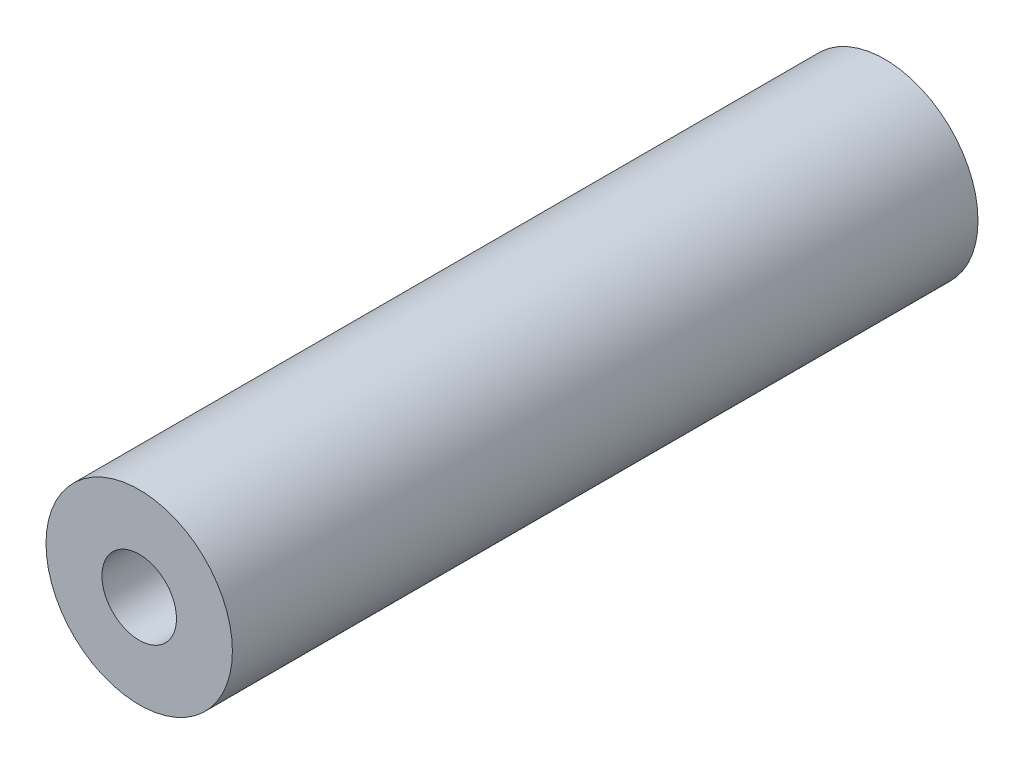
from build123d import *

# Parameters (mm, degrees)
STANDOFF_OD8_ID3P2_PROFILE_R   = 4
STANDOFF_OD8_ID3P2_PROFILE_R_2 = 1.6
STANDOFF_OD8_ID3P2_DEPTH       = 32


with BuildPart() as part:
    # Standoff_OD8_ID3p2_profile → Standoff_OD8_ID3p2 (new body)
    with BuildSketch(Plane.XY):
        Circle(STANDOFF_OD8_ID3P2_PROFILE_R)
        Circle(STANDOFF_OD8_ID3P2_PROFILE_R_2, mode=Mode.SUBTRACT)
    extrude(amount=STANDOFF_OD8_ID3P2_DEPTH)


solid = part.part
